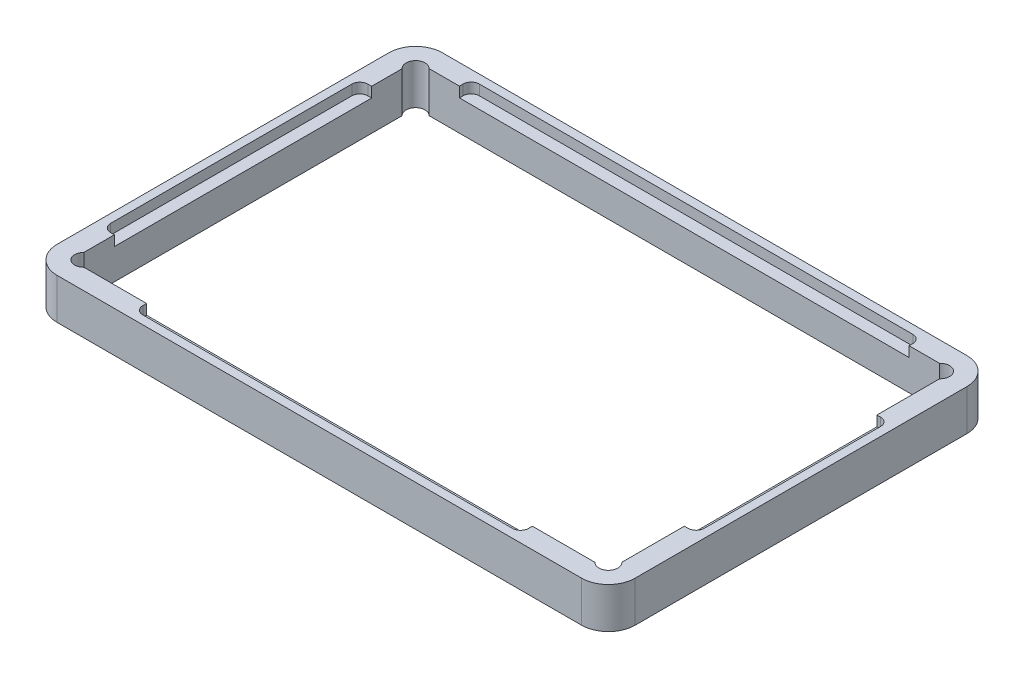
from build123d import *

# Parameters (mm, degrees)
BOSS_EXTRUDE3_DEPTH = 6.35
SKETCH5_R           = 1.4224
SKETCH5_R_2         = 1.4732
CUT_EXTRUDE2_DEPTH  = 55.454774814
CUT_EXTRUDE3_DEPTH  = 1.5875


with BuildPart() as part:
    # Sketch2 → Boss-Extrude3 (new body)
    with BuildSketch(Plane(origin=(0, 0, 0), x_dir=(1, 0, 0), z_dir=(0, 1, 0))):
        with BuildLine():
            Line((-45, 25.825), (-45, -25.825))
            ThreePointArc((-45, -25.825), (-43.777170811, -28.777170811), (-40.825, -30))
            Line((-40.825, -30), (40.825, -30))
            ThreePointArc((40.825, -30), (43.777170811, -28.777170811), (45, -25.825))
            Line((45, -25.825), (45, 25.825))
            ThreePointArc((45, 25.825), (43.777170811, 28.777170811), (40.825, 30))
            Line((40.825, 30), (-40.825, 30))
            ThreePointArc((-40.825, 30), (-43.777170811, 28.777170811), (-45, 25.825))
        make_face()
        with BuildLine():
            Line((-41.825, -25.825), (-41.825, 25.825))
            ThreePointArc((-41.825, 25.825), (-41.532106781, 26.532106781), (-40.825, 26.825))
            Line((-40.825, 26.825), (40.825, 26.825))
            ThreePointArc((40.825, 26.825), (41.532106781, 26.532106781), (41.825, 25.825))
            Line((41.825, 25.825), (41.825, -25.825))
            ThreePointArc((41.825, -25.825), (41.532106781, -26.532106781), (40.825, -26.825))
            Line((40.825, -26.825), (-40.825, -26.825))
            ThreePointArc((-40.825, -26.825), (-41.532106781, -26.532106781), (-41.825, -25.825))
        make_face(mode=Mode.SUBTRACT)
    extrude(amount=BOSS_EXTRUDE3_DEPTH)

    # Sketch5 → Cut-Extrude2 (cut, through all)
    with BuildSketch(Plane.XZ):
        with Locations((-40.825, 25.825)):
            Circle(SKETCH5_R)
        with Locations((40.825, 25.81487963)):
            Circle(SKETCH5_R_2)
        with Locations((40.825, -25.825)):
            Circle(SKETCH5_R_2)
        with Locations((-40.825, -25.81356336)):
            Circle(SKETCH5_R_2)
    extrude(amount=-CUT_EXTRUDE2_DEPTH, mode=Mode.SUBTRACT)

    # Sketch7 → Cut-Extrude3 (cut)
    with BuildSketch(Plane(origin=(0, 6.35, 0), x_dir=(1, 0, 0), z_dir=(0, 1, 0))):
        with BuildLine():
            Line((-35.00387248, 27.407439815), (-35.00387248, 25.81487963))
            Line((-35.00387248, 25.81487963), (34.993187521, 25.81487963))
            Line((34.993187521, 25.81487963), (34.993187521, 27.407439815))
            ThreePointArc((34.993187521, 27.407439815), (34.627070997, 28.291323292), (33.743187521, 28.657439815))
            Line((33.743187521, 28.657439815), (-33.75387248, 28.657439815))
            ThreePointArc((-33.75387248, 28.657439815), (-34.637755957, 28.291323292), (-35.00387248, 27.407439815))
        make_face()
        with BuildLine():
            Line((-43.6625, -18.823576125), (-43.6625, 18.721630511))
            ThreePointArc((-43.6625, 18.721630511), (-43.296383476, 19.605513988), (-42.4125, 19.971630511))
            Line((-42.4125, 19.971630511), (-40.825, 19.971630511))
            Line((-40.825, 19.971630511), (-40.825, -20.073576125))
            Line((-40.825, -20.073576125), (-42.4125, -20.073576125))
            ThreePointArc((-42.4125, -20.073576125), (-43.296383476, -19.707459601), (-43.6625, -18.823576125))
        make_face()
        with BuildLine():
            Line((40.825, 14.983067151), (42.4125, 14.983067151))
            ThreePointArc((42.4125, 14.983067151), (43.296383476, 14.616950627), (43.6625, 13.733067151))
            Line((43.6625, 13.733067151), (43.6625, -13.743187521))
            ThreePointArc((43.6625, -13.743187521), (43.296383476, -14.627070997), (42.4125, -14.993187521))
            Line((42.4125, -14.993187521), (40.825, -14.993187521))
            Line((40.825, -14.993187521), (40.825, 14.983067151))
        make_face()
        with BuildLine():
            Line((-28.813455755, -28.667560185), (28.75263109, -28.667560185))
            ThreePointArc((28.75263109, -28.667560185), (29.636514567, -28.301443661), (30.00263109, -27.417560185))
            Line((30.00263109, -27.417560185), (30.00263109, -25.83512037))
            Line((30.00263109, -25.83512037), (-30.063455755, -25.83512037))
            Line((-30.063455755, -25.83512037), (-30.063455755, -27.417560185))
            ThreePointArc((-30.063455755, -27.417560185), (-29.697339231, -28.301443661), (-28.813455755, -28.667560185))
        make_face()
    extrude(amount=-CUT_EXTRUDE3_DEPTH, mode=Mode.SUBTRACT)


solid = part.part
